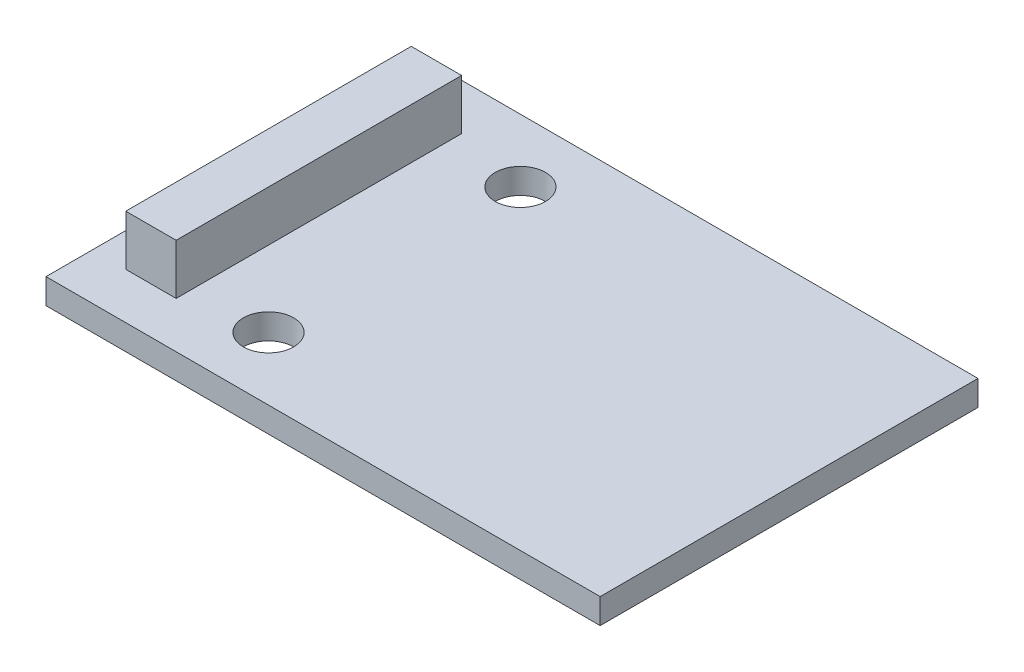
from build123d import *

# Parameters (mm, degrees)
SKETCH1_W           = 33
SKETCH1_H           = 22.5
SKETCH1_R           = 1.5
BOSS_EXTRUDE1_DEPTH = 1.5
SKETCH2_W           = 3
SKETCH2_H           = 17
BOSS_EXTRUDE2_DEPTH = 3


with BuildPart() as part:
    # Sketch1 → Boss-Extrude1 (new body)
    with BuildSketch(Plane(origin=(0, 0, 0), x_dir=(1, 0, 0), z_dir=(0, 1, 0))):
        with Locations((-34.615806323, -30.806469427)):
            Rectangle(SKETCH1_W, SKETCH1_H)
        with Locations(Location((-41.615806323, -38.306469427, 0), (0, 0, 270))):
            Circle(SKETCH1_R, mode=Mode.SUBTRACT)
        with Locations(Location((-41.615806323, -23.306469427, 0), (0, 0, 270))):
            Circle(SKETCH1_R, mode=Mode.SUBTRACT)
    extrude(amount=BOSS_EXTRUDE1_DEPTH)

    # Sketch2 → Boss-Extrude2 (add)
    with BuildSketch(Plane(origin=(0, 1.5, 0), x_dir=(1, 0, 0), z_dir=(0, 1, 0))):
        with Locations((-47.615806323, -30.806469427)):
            Rectangle(SKETCH2_W, SKETCH2_H)
    extrude(amount=BOSS_EXTRUDE2_DEPTH)


solid = part.part
